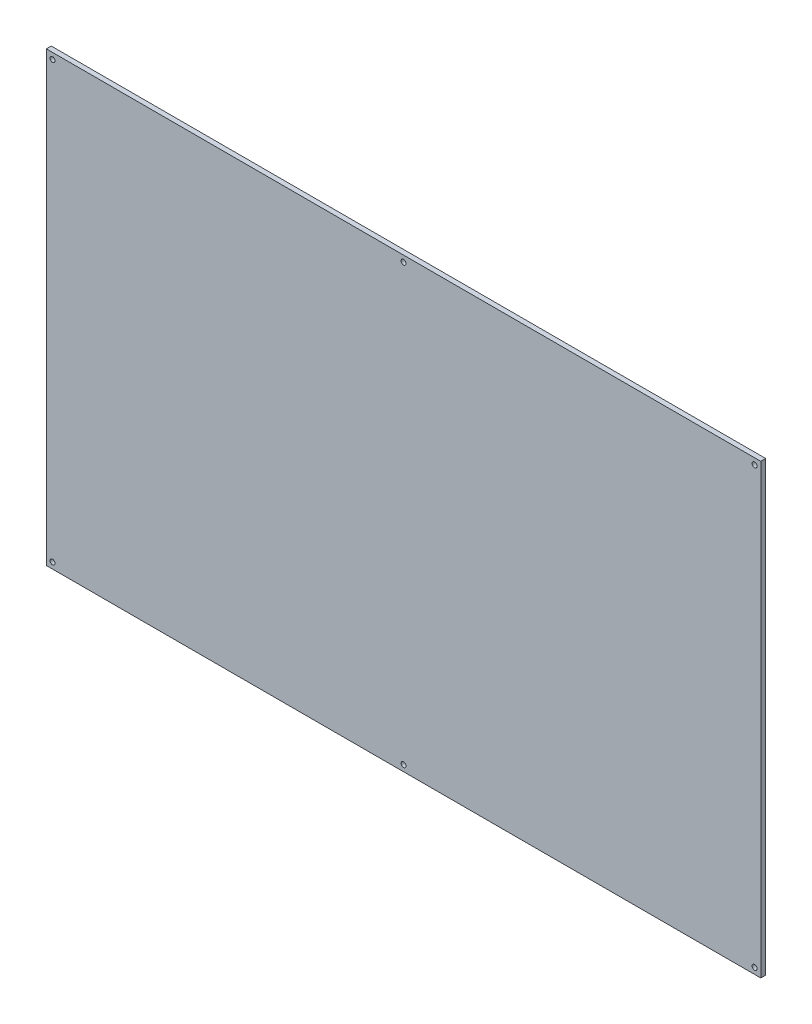
from build123d import *

# Parameters (mm, degrees)
ESQUISSE1_W        = 290.43
ESQUISSE1_H        = 181.9
ESQUISSE1_R        = 1
BOSS_EXTRU_1_DEPTH = 2


with BuildPart() as part:
    # Esquisse1 → Boss.-Extru.1 (new body)
    with BuildSketch(Plane.XY):
        with Locations((98.333322332, -62.378516058)):
            Rectangle(ESQUISSE1_W, ESQUISSE1_H)
        with Locations((-44.381677668, 26.071483942)):
            Circle(ESQUISSE1_R, mode=Mode.SUBTRACT)
        with Locations((98.328322332, 26.071483942)):
            Circle(ESQUISSE1_R, mode=Mode.SUBTRACT)
        with Locations((241.048322332, 26.071483942)):
            Circle(ESQUISSE1_R, mode=Mode.SUBTRACT)
        with Locations((241.048322332, -150.828516058)):
            Circle(ESQUISSE1_R, mode=Mode.SUBTRACT)
        with Locations((98.328322332, -150.828516058)):
            Circle(ESQUISSE1_R, mode=Mode.SUBTRACT)
        with Locations((-44.381677668, -150.828516058)):
            Circle(ESQUISSE1_R, mode=Mode.SUBTRACT)
    extrude(amount=BOSS_EXTRU_1_DEPTH)


solid = part.part
